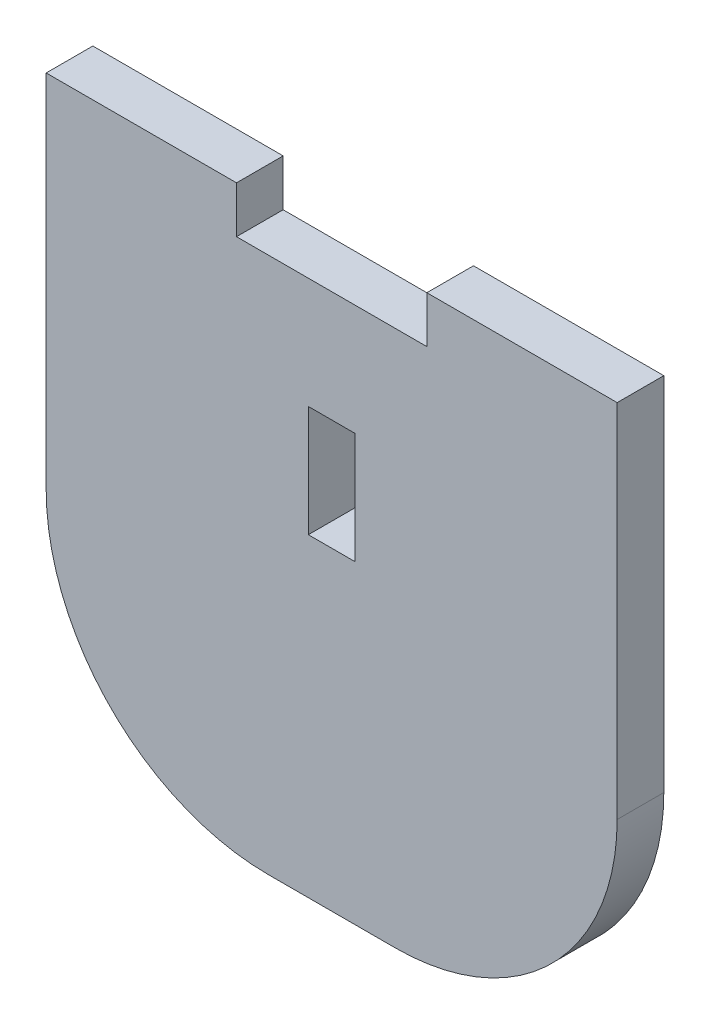
from build123d import *

# Parameters (mm, degrees)
SKETCH1_W           = 65.278
SKETCH1_H           = 66.675
BOSS_EXTRUDE1_DEPTH = 5.334
SKETCH2_W           = 21.759333334
SKETCH2_H           = 5.334
CUT_EXTRUDE1_DEPTH  = 152.591443439
FILLET1_R           = 25.4
FILLET2_R           = 25.4
SKETCH3_W           = 5.334
SKETCH3_H           = 12.7
CUT_EXTRUDE2_DEPTH  = 152.591443439


with BuildPart() as part:
    # Sketch1 → Boss-Extrude1 (new body)
    with BuildSketch(Plane.XY):
        with Locations((-63.136117913, 84.044955915)):
            Rectangle(SKETCH1_W, SKETCH1_H)
    extrude(amount=BOSS_EXTRUDE1_DEPTH)

    # Sketch2 → Cut-Extrude1 (cut, through all)
    with BuildSketch(Plane.XY.offset(5.334)):
        with Locations((-63.136117913, 114.715455915)):
            Rectangle(SKETCH2_W, SKETCH2_H)
    extrude(amount=-CUT_EXTRUDE1_DEPTH, mode=Mode.SUBTRACT)

    # Fillet1
    fillet1_edges = [part.edges().sort_by_distance(p)[0] for p in [
        (-95.775117913, 50.707455915, 2.667),
    ]]
    fillet(fillet1_edges, radius=FILLET1_R)

    # Fillet2
    fillet2_edges = [part.edges().sort_by_distance(p)[0] for p in [
        (-30.497117913, 50.707455915, 2.667),
    ]]
    fillet(fillet2_edges, radius=FILLET2_R)

    # Sketch3 → Cut-Extrude2 (cut, through all)
    with BuildSketch(Plane.XY.offset(5.334)):
        with Locations((-63.136117913, 92.998455915)):
            Rectangle(SKETCH3_W, SKETCH3_H)
    extrude(amount=-CUT_EXTRUDE2_DEPTH, mode=Mode.SUBTRACT)


solid = part.part
